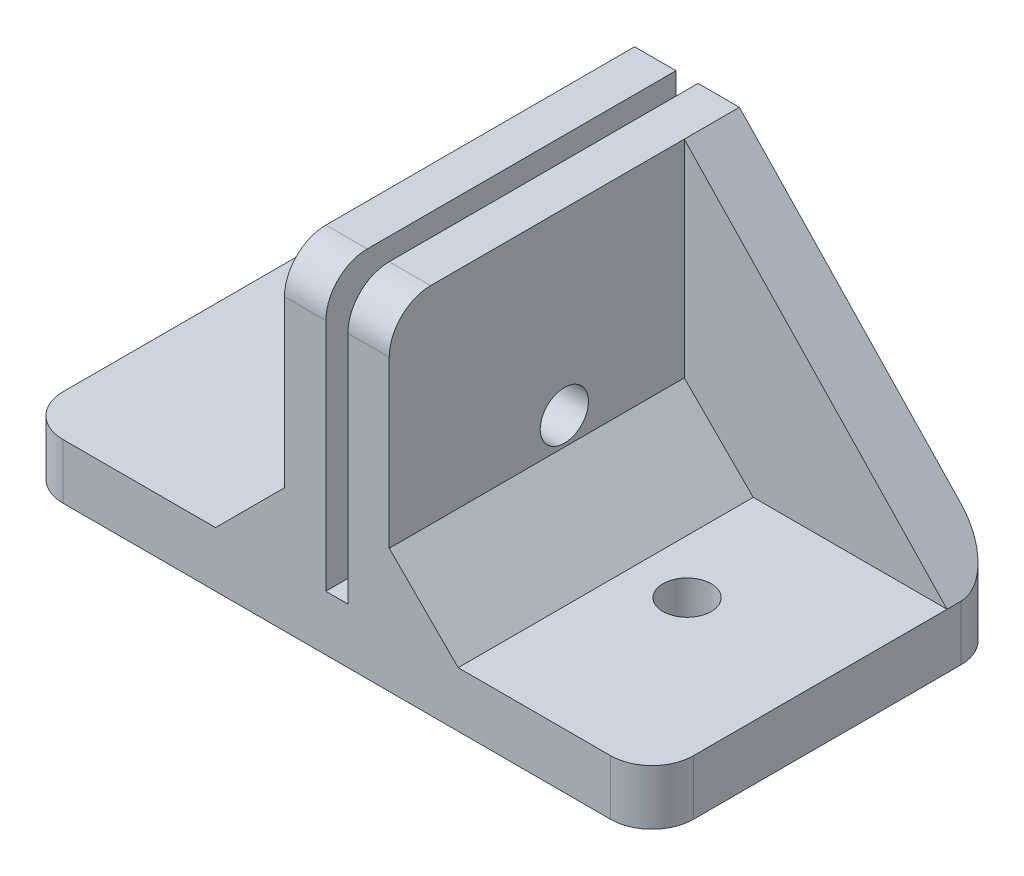
from build123d import *

# Parameters (mm, degrees)
SKETCH1_W           = 45.72
SKETCH1_H           = 25.4
BOSS_EXTRUDE1_DEPTH = 4
SKETCH2_W           = 3
SKETCH2_H           = 25.4
BOSS_EXTRUDE2_DEPTH = 20
CHAMFER1_SIZE       = 5
BOSS_EXTRUDE3_DEPTH = 4
SKETCH4_R           = 1.75
CUT_EXTRUDE1_DEPTH  = 4
SKETCH5_R           = 1.75
CUT_EXTRUDE2_DEPTH  = 14
FILLET1_R           = 3


with BuildPart() as part:
    # Sketch1 → Boss-Extrude1 (new body)
    with BuildSketch(Plane(origin=(0, 0, 0), x_dir=(1, 0, 0), z_dir=(0, 1, 0))):
        Rectangle(SKETCH1_W, SKETCH1_H)
    extrude(amount=BOSS_EXTRUDE1_DEPTH)

    # Sketch2 → Boss-Extrude2 (add)
    with BuildSketch(Plane(origin=(0, 4, 0), x_dir=(1, 0, 0), z_dir=(0, 1, 0))):
        with Locations((-2.3, 0)):
            Rectangle(SKETCH2_W, SKETCH2_H)
        with Locations((2.3, 0)):
            Rectangle(SKETCH2_W, SKETCH2_H)
    extrude(amount=BOSS_EXTRUDE2_DEPTH)

    # Chamfer1
    chamfer1_edges = [part.edges().sort_by_distance(p)[0] for p in [
        (-3.8, 4, 0),
        (3.8, 4, 0),
    ]]
    chamfer(chamfer1_edges, length=CHAMFER1_SIZE)

    # Sketch3 → Boss-Extrude3 (add)
    with BuildSketch(Plane(origin=(0, 0, -12.7), x_dir=(-1, 0, 0), z_dir=(0, 0, -1))):
        Polygon((-3.8, 24), (-22.86, 4), (-3.8, 4), align=None)
        Polygon((3.8, 24), (3.8, 4), (22.86, 4), align=None)
    extrude(amount=-BOSS_EXTRUDE3_DEPTH)

    # Sketch4 → Cut-Extrude1 (cut)
    with BuildSketch(Plane.XZ):
        with Locations(Location((-12.7, 0, 0), (0, 0, 270))):
            Circle(SKETCH4_R)
        with Locations(Location((12.7, 0, 0), (0, 0, 270))):
            Circle(SKETCH4_R)
    extrude(amount=-CUT_EXTRUDE1_DEPTH, mode=Mode.SUBTRACT)

    # Sketch5 → Cut-Extrude2 (cut)
    with BuildSketch(Plane.ZY.offset(3.8)):
        with Locations((0, 11)):
            Circle(SKETCH5_R)
    extrude(amount=-CUT_EXTRUDE2_DEPTH, mode=Mode.SUBTRACT)

    # Fillet1
    fillet1_edges = [part.edges().sort_by_distance(p)[0] for p in [
        (-2.3, 24, 12.7),
        (2.3, 24, 12.7),
        (22.86, 2, 12.7),
        (-22.86, 2, 12.7),
        (-22.86, 2, -12.7),
        (22.86, 2, -12.7),
    ]]
    fillet(fillet1_edges, radius=FILLET1_R)


solid = part.part
